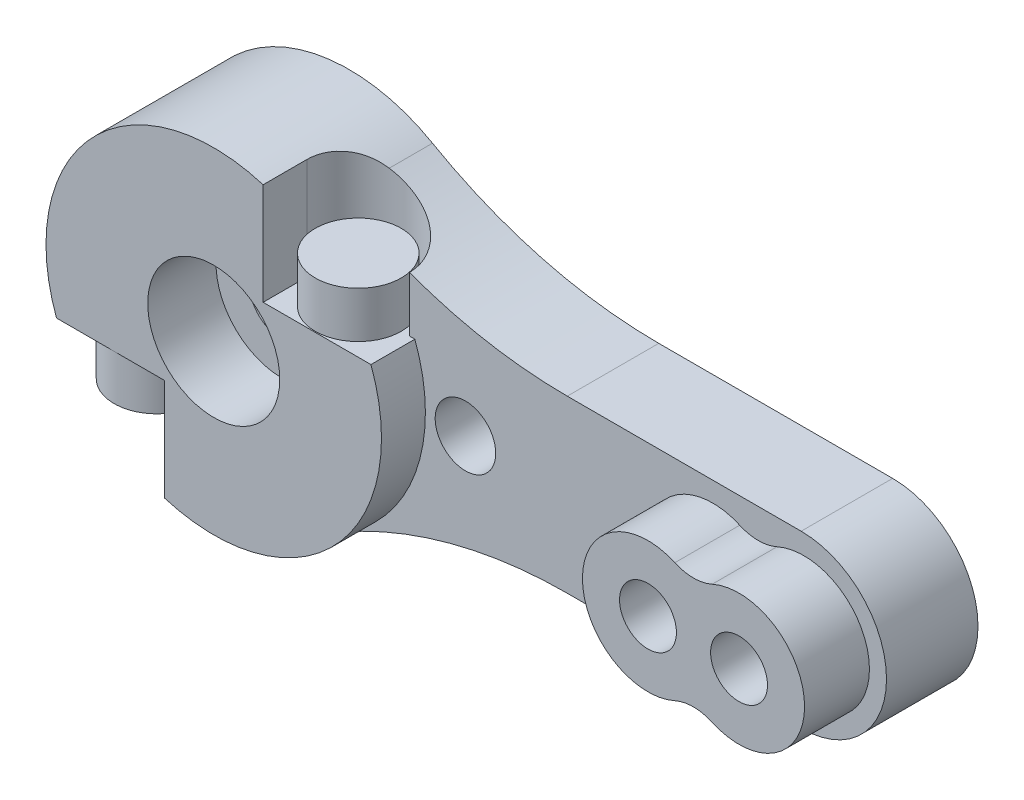
from build123d import *

# Parameters (mm, degrees)
SCHIZZO1_R                   = 1.45
SCHIZZO1_R_2                 = 1.33
ESTRUSIONE_ESTRUSIONE1_DEPTH = 4.02
ESTRUSIONE_ESTRUSIONE2_START = -4.02
SCHIZZO2_R                   = 7.37
SCHIZZO2_R_2                 = 1.45
ESTRUSIONE_ESTRUSIONE2_DEPTH = 5.95
ESTRUSIONE_ESTRUSIONE3_START = -4.02
ESTRUSIONE_ESTRUSIONE3_DEPTH = 6.87
FORO_FILETTATO_M3X0_5_1_D    = 2.5
SCHIZZO6_R                   = 4
TAGLIO_ESTRUSIONE1_DEPTH     = 1.07
SCHIZZO8_R                   = 2.9
TAGLIO_ESTRUSIONE2_DEPTH     = 3
SCHIZZO9_W                   = 0.7
SCHIZZO9_H                   = 1.93
TAGLIO_ESTRUSIONE3_DEPTH     = 4.8
SCHIZZO11_W                  = 0.7
SCHIZZO11_H                  = 1.93
TAGLIO_ESTRUSIONE4_DEPTH     = 4.8
SCHIZZO12_R                  = 1.89
ESTRUSIONE_ESTRUSIONE4_DEPTH = 2.03
SCHIZZO13_R                  = 1.89
ESTRUSIONE_ESTRUSIONE5_DEPTH = 2.03


with BuildPart() as part:
    # Schizzo1 → Estrusione-Estrusione1 (new body)
    with BuildSketch(Plane.XY):
        with BuildLine():
            Line((13.603470146, -3.75), (23.88, -3.75))
            ThreePointArc((23.88, -3.75), (27.63, 0), (23.88, 3.75))
            Line((23.88, 3.75), (13.603470146, 3.75))
            ThreePointArc((13.603470146, 3.75), (8.460288245, 4.422618389), (3.663046217, 6.395232006))
            ThreePointArc((3.663046217, 6.395232006), (-7.37, 0), (3.663046217, -6.395232006))
            ThreePointArc((3.663046217, -6.395232006), (8.460288245, -4.422618389), (13.603470146, -3.75))
        make_face()
        Circle(SCHIZZO1_R, mode=Mode.SUBTRACT)
        with Locations((9.13, 0)):
            Circle(SCHIZZO1_R_2, mode=Mode.SUBTRACT)
    extrude(amount=ESTRUSIONE_ESTRUSIONE1_DEPTH)

    # Schizzo2 → Estrusione-Estrusione2 (add)
    with BuildSketch(Plane.XY.offset(4.02).offset(ESTRUSIONE_ESTRUSIONE2_START)):
        with Locations(Location((0, 0, 0), (0, 0, 180))):
            Circle(SCHIZZO2_R)
        with Locations(Location((0, 0, 0), (0, 0, 180))):
            Circle(SCHIZZO2_R_2, mode=Mode.SUBTRACT)
    extrude(amount=ESTRUSIONE_ESTRUSIONE2_DEPTH)

    # Schizzo3 → Estrusione-Estrusione3 (add)
    with BuildSketch(Plane.XY.offset(4.02).offset(ESTRUSIONE_ESTRUSIONE3_START)):
        with BuildLine():
            ThreePointArc((22.819672131, -2.627018485), (26.88, 0), (22.819672131, 2.627018485))
            ThreePointArc((22.819672131, 2.627018485), (22, 2.451336878), (21.180327869, 2.627018485))
            ThreePointArc((21.180327869, 2.627018485), (17.12, 0), (21.180327869, -2.627018485))
            ThreePointArc((21.180327869, -2.627018485), (22, -2.451336878), (22.819672131, -2.627018485))
        make_face()
    extrude(amount=ESTRUSIONE_ESTRUSIONE3_DEPTH)

    # Foro filettato M3x0.5-1 (through all)
    with Locations(Plane.XY.offset(6.87)):
        with Locations((24, 0), (20, 0)):
            Hole(FORO_FILETTATO_M3X0_5_1_D / 2)

    # Schizzo6 → Taglio-Estrusione1 (cut)
    with BuildSketch(Plane(origin=(0, 0, 0), x_dir=(-1, 0, 0), z_dir=(0, 0, -1))):
        Circle(SCHIZZO6_R)
    extrude(amount=-TAGLIO_ESTRUSIONE1_DEPTH, mode=Mode.SUBTRACT)

    # Schizzo8 → Taglio-Estrusione2 (cut)
    with BuildSketch(Plane.XY.offset(5.95)):
        Circle(SCHIZZO8_R)
    extrude(amount=-TAGLIO_ESTRUSIONE2_DEPTH, mode=Mode.SUBTRACT)

    # Schizzo9 → Taglio-Estrusione3 (cut)
    with BuildSketch(Plane(origin=(0, 7.37, 0), x_dir=(1, 0, 0), z_dir=(0, 1, 0))):
        with BuildLine():
            ThreePointArc((2.17, -4.02), (4.42, -1.77), (6.67, -4.02))
            Line((6.67, -4.02), (6.67, -5.95))
            Line((6.67, -5.95), (2.17, -5.95))
            Line((2.17, -5.95), (2.17, -4.02))
        make_face()
        with Locations((7.02, -4.985)):
            Rectangle(SCHIZZO9_W, SCHIZZO9_H)
    extrude(amount=-TAGLIO_ESTRUSIONE3_DEPTH, mode=Mode.SUBTRACT)

    # Schizzo11 → Taglio-Estrusione4 (cut)
    with BuildSketch(Plane(origin=(0, -7.37, 0), x_dir=(-1, 0, 0), z_dir=(0, -1, 0))):
        with BuildLine():
            ThreePointArc((2.17, -4.02), (4.42, -1.77), (6.67, -4.02))
            Line((6.67, -4.02), (6.67, -5.95))
            Line((6.67, -5.95), (2.17, -5.95))
            Line((2.17, -5.95), (2.17, -4.02))
        make_face()
        with Locations((7.02, -4.985)):
            Rectangle(SCHIZZO11_W, SCHIZZO11_H)
    extrude(amount=-TAGLIO_ESTRUSIONE4_DEPTH, mode=Mode.SUBTRACT)

    # Schizzo12 → Estrusione-Estrusione4 (add)
    with BuildSketch(Plane(origin=(0, 2.57, 0), x_dir=(1, 0, 0), z_dir=(0, 1, 0))):
        with Locations(Location((4.42, -4.02, 0), (0, 0, 270))):
            Circle(SCHIZZO12_R)
    extrude(amount=ESTRUSIONE_ESTRUSIONE4_DEPTH)

    # Schizzo13 → Estrusione-Estrusione5 (add)
    with BuildSketch(Plane(origin=(0, -2.57, 0), x_dir=(-1, 0, 0), z_dir=(0, -1, 0))):
        with Locations(Location((4.42, -4.02, 0), (0, 0, 90))):
            Circle(SCHIZZO13_R)
    extrude(amount=ESTRUSIONE_ESTRUSIONE5_DEPTH)


solid = part.part
